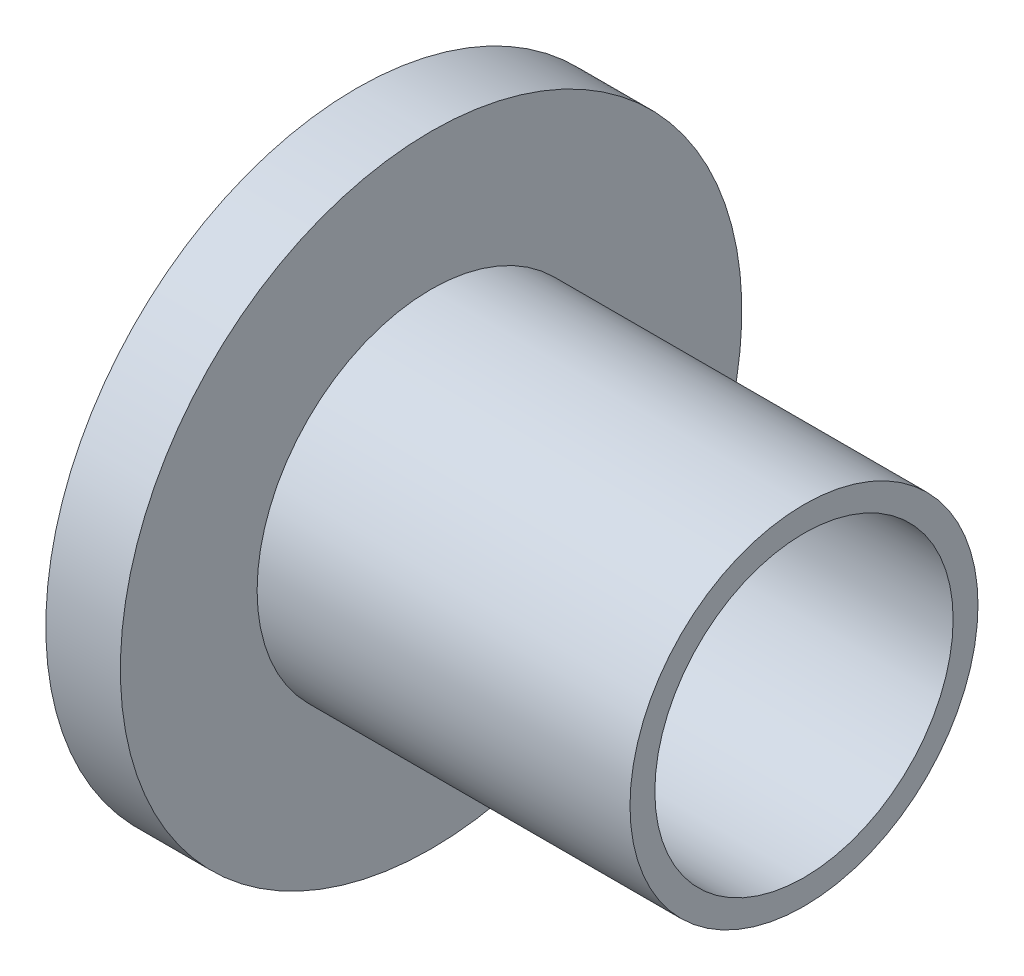
from build123d import *


with BuildPart() as part:
    # Sketch1 → Revolve1 (revolve)
    with BuildSketch(Plane.XY, mode=Mode.PRIVATE) as revolve1_sk:
        Polygon((-6, 25), (-6, 7.5), (-16, 7.5), (-16, 6.5), (-3, 6.5), (-3, 10), (0, 10), (0, 12), (30, 12), (30, 14), (0, 14), (0, 25), align=None)
    revolve(revolve1_sk.sketch.rotate(Axis((-64.900117457, 0, 0), (1, 0, 0)), 180), axis=Axis((-64.900117457, 0, 0), (1, 0, 0)))


solid = part.part
